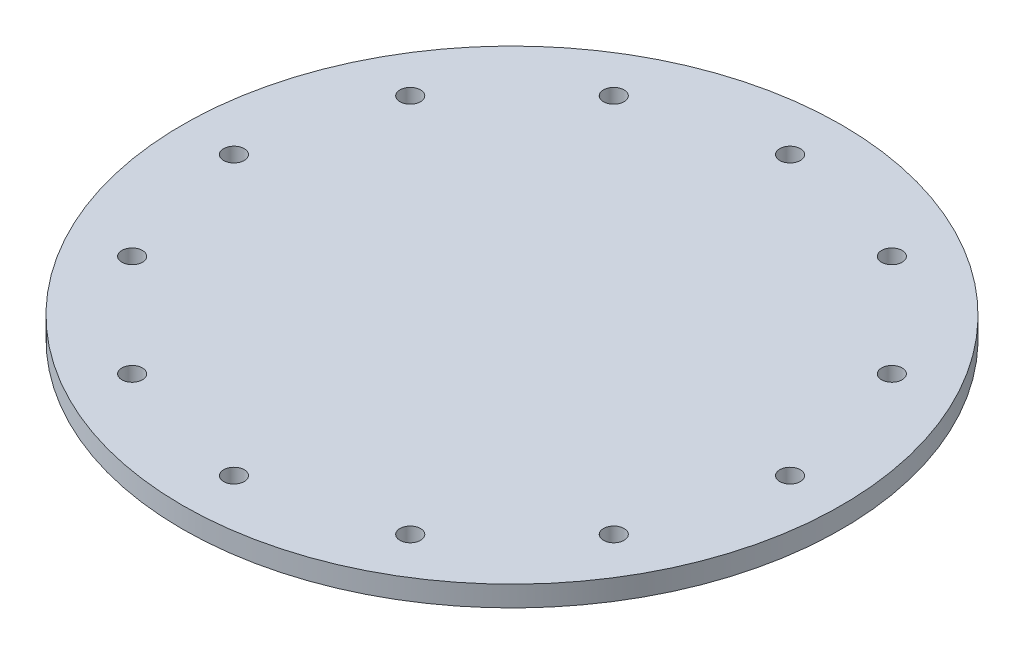
from build123d import *

# Parameters (mm, degrees)
SKETCH1_R           = 101.6
BOSS_EXTRUDE1_DEPTH = 6.35
CUT_EXTRUDE2_REACH  = 145.824
SKETCH3_R           = 3.175


with BuildPart() as part:
    # Sketch1 → Boss-Extrude1 (new body)
    with BuildSketch(Plane(origin=(0, 0, 0), x_dir=(1, 0, 0), z_dir=(0, 1, 0))):
        with Locations(Location((0, 0, 0), (0, 0, 270))):
            Circle(SKETCH1_R)
    extrude(amount=BOSS_EXTRUDE1_DEPTH)

    # Sketch3 → Cut-Extrude2 (cut, up to next)
    with BuildSketch(Plane(origin=(0, 6.35, 0), x_dir=(1, 0, 0), z_dir=(0, 1, 0)), mode=Mode.PRIVATE) as cut_extrude2_sk1:
        with Locations(Location((0, 85.725, 0), (0, 0, 270))):
            Circle(SKETCH3_R)
    cut_extrude2_tool1 = extrude(cut_extrude2_sk1.sketch, amount=-CUT_EXTRUDE2_REACH, mode=Mode.PRIVATE) & part.part
    # Sketch3 → Cut-Extrude2 (cut, up to next)
    with BuildSketch(Plane(origin=(0, 6.35, 0), x_dir=(1, 0, 0), z_dir=(0, 1, 0)), mode=Mode.PRIVATE) as cut_extrude2_sk2:
        with Locations(Location((42.8625, 74.240027739, 0), (0, 0, 270))):
            Circle(SKETCH3_R)
    cut_extrude2_tool2 = extrude(cut_extrude2_sk2.sketch, amount=-CUT_EXTRUDE2_REACH, mode=Mode.PRIVATE) & part.part
    # Sketch3 → Cut-Extrude2 (cut, up to next)
    with BuildSketch(Plane(origin=(0, 6.35, 0), x_dir=(1, 0, 0), z_dir=(0, 1, 0)), mode=Mode.PRIVATE) as cut_extrude2_sk3:
        with Locations(Location((74.240027739, 42.8625, 0), (0, 0, 270))):
            Circle(SKETCH3_R)
    cut_extrude2_tool3 = extrude(cut_extrude2_sk3.sketch, amount=-CUT_EXTRUDE2_REACH, mode=Mode.PRIVATE) & part.part
    # Sketch3 → Cut-Extrude2 (cut, up to next)
    with BuildSketch(Plane(origin=(0, 6.35, 0), x_dir=(1, 0, 0), z_dir=(0, 1, 0)), mode=Mode.PRIVATE) as cut_extrude2_sk4:
        with Locations(Location((85.725, 0, 0), (0, 0, 270))):
            Circle(SKETCH3_R)
    cut_extrude2_tool4 = extrude(cut_extrude2_sk4.sketch, amount=-CUT_EXTRUDE2_REACH, mode=Mode.PRIVATE) & part.part
    # Sketch3 → Cut-Extrude2 (cut, up to next)
    with BuildSketch(Plane(origin=(0, 6.35, 0), x_dir=(1, 0, 0), z_dir=(0, 1, 0)), mode=Mode.PRIVATE) as cut_extrude2_sk5:
        with Locations(Location((74.240027739, -42.8625, 0), (0, 0, 270))):
            Circle(SKETCH3_R)
    cut_extrude2_tool5 = extrude(cut_extrude2_sk5.sketch, amount=-CUT_EXTRUDE2_REACH, mode=Mode.PRIVATE) & part.part
    # Sketch3 → Cut-Extrude2 (cut, up to next)
    with BuildSketch(Plane(origin=(0, 6.35, 0), x_dir=(1, 0, 0), z_dir=(0, 1, 0)), mode=Mode.PRIVATE) as cut_extrude2_sk6:
        with Locations(Location((42.8625, -74.240027739, 0), (0, 0, 270))):
            Circle(SKETCH3_R)
    cut_extrude2_tool6 = extrude(cut_extrude2_sk6.sketch, amount=-CUT_EXTRUDE2_REACH, mode=Mode.PRIVATE) & part.part
    # Sketch3 → Cut-Extrude2 (cut, up to next)
    with BuildSketch(Plane(origin=(0, 6.35, 0), x_dir=(1, 0, 0), z_dir=(0, 1, 0)), mode=Mode.PRIVATE) as cut_extrude2_sk7:
        with Locations(Location((0, -85.725, 0), (0, 0, 270))):
            Circle(SKETCH3_R)
    cut_extrude2_tool7 = extrude(cut_extrude2_sk7.sketch, amount=-CUT_EXTRUDE2_REACH, mode=Mode.PRIVATE) & part.part
    # Sketch3 → Cut-Extrude2 (cut, up to next)
    with BuildSketch(Plane(origin=(0, 6.35, 0), x_dir=(1, 0, 0), z_dir=(0, 1, 0)), mode=Mode.PRIVATE) as cut_extrude2_sk8:
        with Locations(Location((-42.8625, -74.240027739, 0), (0, 0, 270))):
            Circle(SKETCH3_R)
    cut_extrude2_tool8 = extrude(cut_extrude2_sk8.sketch, amount=-CUT_EXTRUDE2_REACH, mode=Mode.PRIVATE) & part.part
    # Sketch3 → Cut-Extrude2 (cut, up to next)
    with BuildSketch(Plane(origin=(0, 6.35, 0), x_dir=(1, 0, 0), z_dir=(0, 1, 0)), mode=Mode.PRIVATE) as cut_extrude2_sk9:
        with Locations(Location((-74.240027739, -42.8625, 0), (0, 0, 270))):
            Circle(SKETCH3_R)
    cut_extrude2_tool9 = extrude(cut_extrude2_sk9.sketch, amount=-CUT_EXTRUDE2_REACH, mode=Mode.PRIVATE) & part.part
    # Sketch3 → Cut-Extrude2 (cut, up to next)
    with BuildSketch(Plane(origin=(0, 6.35, 0), x_dir=(1, 0, 0), z_dir=(0, 1, 0)), mode=Mode.PRIVATE) as cut_extrude2_sk10:
        with Locations(Location((-85.725, 0, 0), (0, 0, 270))):
            Circle(SKETCH3_R)
    cut_extrude2_tool10 = extrude(cut_extrude2_sk10.sketch, amount=-CUT_EXTRUDE2_REACH, mode=Mode.PRIVATE) & part.part
    # Sketch3 → Cut-Extrude2 (cut, up to next)
    with BuildSketch(Plane(origin=(0, 6.35, 0), x_dir=(1, 0, 0), z_dir=(0, 1, 0)), mode=Mode.PRIVATE) as cut_extrude2_sk11:
        with Locations(Location((-74.240027739, 42.8625, 0), (0, 0, 270))):
            Circle(SKETCH3_R)
    cut_extrude2_tool11 = extrude(cut_extrude2_sk11.sketch, amount=-CUT_EXTRUDE2_REACH, mode=Mode.PRIVATE) & part.part
    # Sketch3 → Cut-Extrude2 (cut, up to next)
    with BuildSketch(Plane(origin=(0, 6.35, 0), x_dir=(1, 0, 0), z_dir=(0, 1, 0)), mode=Mode.PRIVATE) as cut_extrude2_sk12:
        with Locations(Location((-42.8625, 74.240027739, 0), (0, 0, 270))):
            Circle(SKETCH3_R)
    cut_extrude2_tool12 = extrude(cut_extrude2_sk12.sketch, amount=-CUT_EXTRUDE2_REACH, mode=Mode.PRIVATE) & part.part
    add(cut_extrude2_tool1.solids().sort_by_distance((0, 6.35, -85.725))[0], mode=Mode.SUBTRACT)
    add(cut_extrude2_tool2.solids().sort_by_distance((42.8625, 6.35, -74.240028))[0], mode=Mode.SUBTRACT)
    add(cut_extrude2_tool3.solids().sort_by_distance((74.240028, 6.35, -42.8625))[0], mode=Mode.SUBTRACT)
    add(cut_extrude2_tool4.solids().sort_by_distance((85.725, 6.35, 0))[0], mode=Mode.SUBTRACT)
    add(cut_extrude2_tool5.solids().sort_by_distance((74.240028, 6.35, 42.8625))[0], mode=Mode.SUBTRACT)
    add(cut_extrude2_tool6.solids().sort_by_distance((42.8625, 6.35, 74.240028))[0], mode=Mode.SUBTRACT)
    add(cut_extrude2_tool7.solids().sort_by_distance((0, 6.35, 85.725))[0], mode=Mode.SUBTRACT)
    add(cut_extrude2_tool8.solids().sort_by_distance((-42.8625, 6.35, 74.240028))[0], mode=Mode.SUBTRACT)
    add(cut_extrude2_tool9.solids().sort_by_distance((-74.240028, 6.35, 42.8625))[0], mode=Mode.SUBTRACT)
    add(cut_extrude2_tool10.solids().sort_by_distance((-85.725, 6.35, 0))[0], mode=Mode.SUBTRACT)
    add(cut_extrude2_tool11.solids().sort_by_distance((-74.240028, 6.35, -42.8625))[0], mode=Mode.SUBTRACT)
    add(cut_extrude2_tool12.solids().sort_by_distance((-42.8625, 6.35, -74.240028))[0], mode=Mode.SUBTRACT)


solid = part.part
